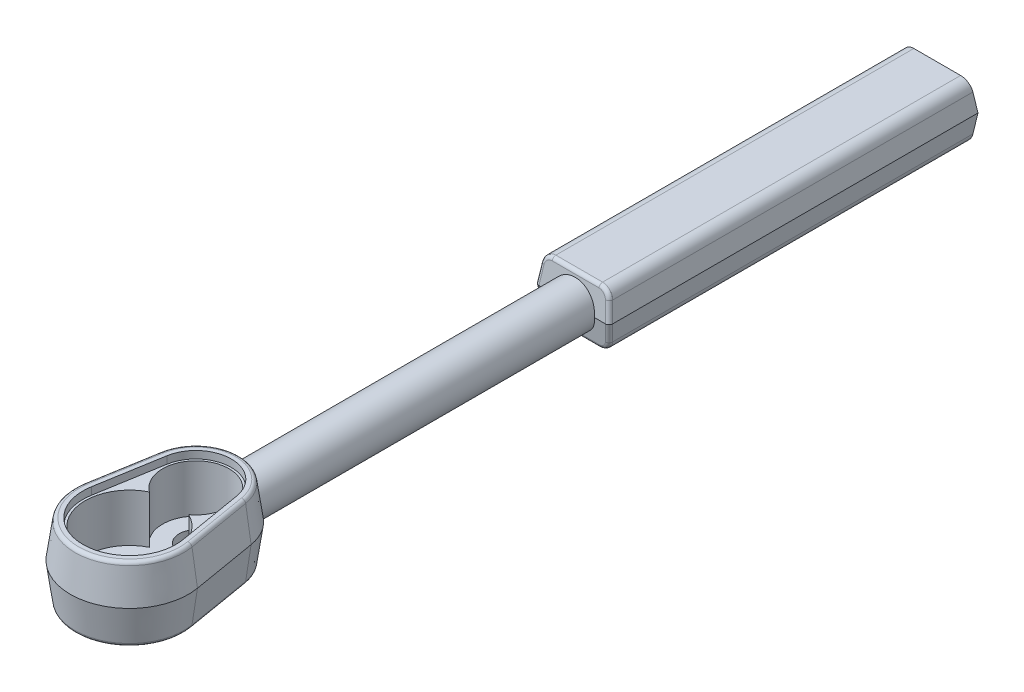
from build123d import *

# Parameters (mm, degrees)
SKETCH1_W                     = 20
SKETCH1_H                     = 100
HANDLE_DEPTH                  = 7.5
HANDLE_TAPER                  = 8
HANDLE_OTHER_WAY_DEPTH        = 7.5
HANDLE_OTHER_WAY_TAPER        = 8
TRANSITION_REACH              = 222.355
SKETCH2_R                     = 6
BOSS_EXTRUDE3_DEPTH           = 10
BOSS_EXTRUDE3_TAPER           = 8
BOSS_EXTRUDE3_OTHER_WAY_DEPTH = 10
BOSS_EXTRUDE3_OTHER_WAY_TAPER = 8
RECESS_DEPTH                  = 2
OFFSET_2_DEPTH                = 13
SKETCH7_R                     = 4.5
WHEELHOLE_DEPTH               = 222.09047933
SKETCH8_R                     = 4.5
CUT_EXTRUDE4_DEPTH            = 222.09047933
HANDLE_FILLET_R               = 3
FILLET2_R                     = 1
FILLET3_R                     = 1


with BuildPart() as part:
    # Sketch1 → Handle (new body)
    with BuildSketch(Plane(origin=(0, 0, 0), x_dir=(1, 0, 0), z_dir=(0, 1, 0))):
        with Locations((0, 170)):
            Rectangle(SKETCH1_W, SKETCH1_H)
    extrude(amount=HANDLE_DEPTH, taper=HANDLE_TAPER)

    # Sketch1 → Handle other way (add)
    with BuildSketch(Plane(origin=(0, 0, 0), x_dir=(1, 0, 0), z_dir=(0, 1, 0))):
        with Locations((0, 170)):
            Rectangle(SKETCH1_W, SKETCH1_H)
    extrude(amount=-HANDLE_OTHER_WAY_DEPTH, taper=HANDLE_OTHER_WAY_TAPER)

    # Sketch2 → Transition (add, up to next)
    with BuildSketch(Plane.XY, mode=Mode.PRIVATE) as transition_sk1:
        Circle(SKETCH2_R)
    transition_tool1 = extrude(transition_sk1.sketch, amount=-TRANSITION_REACH, mode=Mode.PRIVATE) - part.part
    add(transition_tool1.solids().sort_by_distance((0, 0, 0))[0])

    # Sketch3 → Boss-Extrude3 (add)
    with BuildSketch(Plane(origin=(0, 0, 0), x_dir=(1, 0, 0), z_dir=(0, 1, 0))):
        with BuildLine():
            ThreePointArc((12.818172863, 20.166666667), (0, 31), (-12.818172863, 20.166666667))
            Line((-12.818172863, 20.166666667), (-15.776212755, 2.666666667))
            ThreePointArc((-15.776212755, 2.666666667), (0, -16), (15.776212755, 2.666666667))
            Line((15.776212755, 2.666666667), (12.818172863, 20.166666667))
        make_face()
    extrude(amount=BOSS_EXTRUDE3_DEPTH, taper=BOSS_EXTRUDE3_TAPER)

    # Sketch3 → Boss-Extrude3 other way (add)
    with BuildSketch(Plane(origin=(0, 0, 0), x_dir=(1, 0, 0), z_dir=(0, 1, 0))):
        with BuildLine():
            ThreePointArc((12.818172863, 20.166666667), (0, 31), (-12.818172863, 20.166666667))
            Line((-12.818172863, 20.166666667), (-15.776212755, 2.666666667))
            ThreePointArc((-15.776212755, 2.666666667), (0, -16), (15.776212755, 2.666666667))
            Line((15.776212755, 2.666666667), (12.818172863, 20.166666667))
        make_face()
    extrude(amount=-BOSS_EXTRUDE3_OTHER_WAY_DEPTH, taper=BOSS_EXTRUDE3_OTHER_WAY_TAPER)

    # Sketch4 → Recess (cut)
    with BuildSketch(Plane(origin=(0, 10, 0), x_dir=(1, 0, 0), z_dir=(0, 1, 0))):
        with BuildLine():
            Line((-9.460394951, 19.599098609), (-12.418434842, 2.099098609))
            ThreePointArc((-12.418434842, 2.099098609), (0, -12.594591653), (12.418434842, 2.099098609))
            Line((12.418434842, 2.099098609), (9.460394951, 19.599098609))
            ThreePointArc((9.460394951, 19.599098609), (0, 27.594591653), (-9.460394951, 19.599098609))
        make_face()
    extrude(amount=-RECESS_DEPTH, mode=Mode.SUBTRACT)

    # Sketch5 → Offset 2 (cut)
    with BuildSketch(Plane(origin=(0, 8, 0), x_dir=(1, 0, 0), z_dir=(0, 1, 0))):
        with BuildLine():
            ThreePointArc((-5.332682252, 10.75), (0, -12), (5.332682252, 10.75))
            ThreePointArc((5.332682252, 10.75), (0, 27), (-5.332682252, 10.75))
        make_face()
    extrude(amount=-OFFSET_2_DEPTH, mode=Mode.SUBTRACT)

    # Sketch7 → WheelHole (cut, through all)
    with BuildSketch(Plane(origin=(0, -5, 0), x_dir=(1, 0, 0), z_dir=(0, 1, 0))):
        with Locations(Location((0, 18, 0), (0, 0, 270))):
            Circle(SKETCH7_R)
    extrude(amount=-WHEELHOLE_DEPTH, mode=Mode.SUBTRACT)

    # Sketch8 → Cut-Extrude4 (cut, through all)
    with BuildSketch(Plane(origin=(0, -5, 0), x_dir=(1, 0, 0), z_dir=(0, 1, 0))):
        with Locations(Location((0, 0, 0), (0, 0, 270))):
            Circle(SKETCH8_R)
    extrude(amount=-CUT_EXTRUDE4_DEPTH, mode=Mode.SUBTRACT)

    # Handle Fillet
    handle_fillet_edges = [part.edges().sort_by_distance(p)[0] for p in [
        (8.94594374, 7.5, -170),
        (-8.94594374, 7.5, -170),
        (-8.94594374, -7.5, -170),
        (8.94594374, -7.5, -170),
    ]]
    fillet(handle_fillet_edges, radius=HANDLE_FILLET_R)

    # Fillet2
    fillet2_edges = [part.edges().sort_by_distance(p)[0] for p in [
        (0, 7.5, -121.05405626),
        (9.654443866, 2.458759651, -120.345556134),
        (-9.654443866, 2.458759651, -120.345556134),
        (8.310979995, 6.760017588, -120.950058514),
        (-8.310979995, 6.760017588, -120.950058514),
        (-9.654443866, -2.458759651, -120.345556134),
        (0, -7.5, -121.05405626),
        (9.654443866, -2.458759651, -120.345556134),
        (8.310979995, -6.760017588, -120.950058514),
        (-8.310979995, -6.760017588, -120.950058514),
    ]]
    fillet(fillet2_edges, radius=FILLET2_R)

    # Fillet3
    fillet3_edges = [part.edges().sort_by_distance(p)[0] for p in [
        (-12.911441491, -10, -11.182431942),
        (0, -10, -29.594591653),
        (12.911441491, -10, -11.182431942),
        (0, -10, 14.594591653),
        (0, 10, -29.594591653),
        (0, 10, 14.594591653),
        (12.911441491, 10, -11.182431942),
        (-12.911441491, 10, -11.182431942),
    ]]
    fillet(fillet3_edges, radius=FILLET3_R)


solid = part.part
